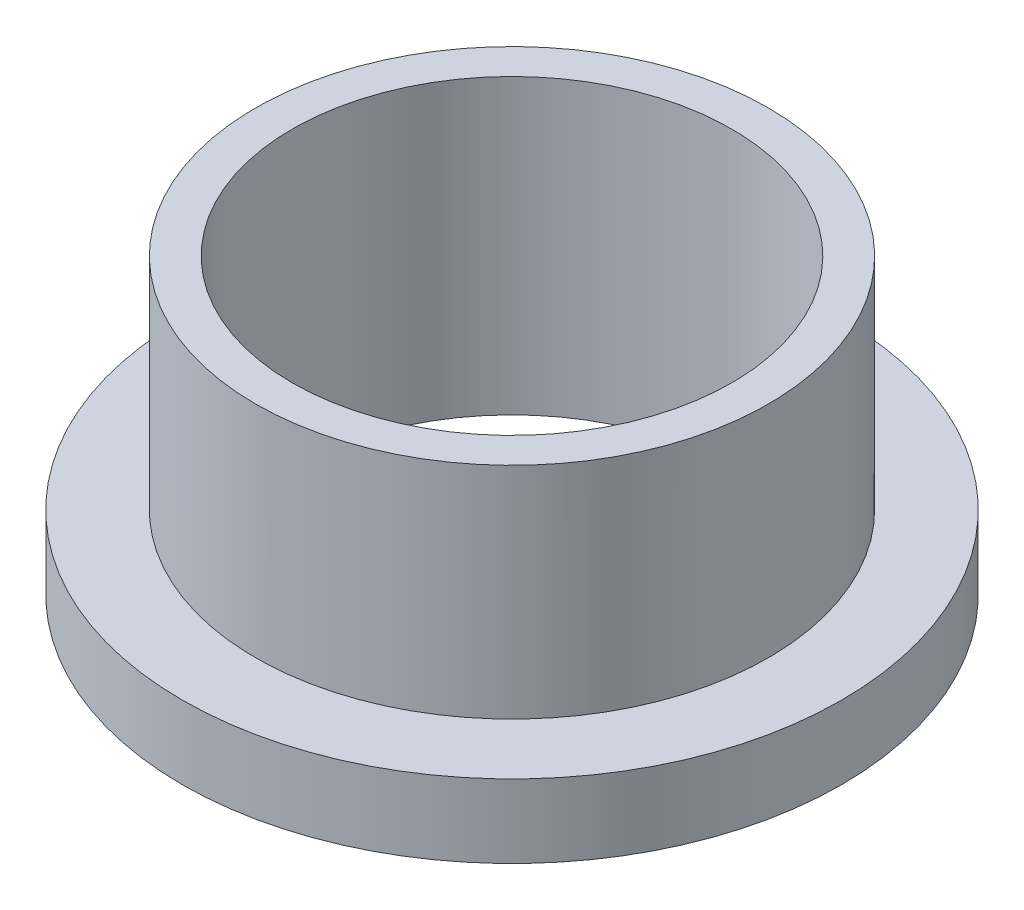
from build123d import *

# Parameters (mm, degrees)
SKETCH1_R           = 11.1125
SKETCH1_R_2         = 9.525
BOSS_EXTRUDE1_DEPTH = 12.7
SKETCH2_R           = 14.2875
SKETCH2_R_2         = 11.1125
BOSS_EXTRUDE2_DEPTH = 3.175


with BuildPart() as part:
    # Sketch1 → Boss-Extrude1 (new body)
    with BuildSketch(Plane(origin=(0, 0, 0), x_dir=(1, 0, 0), z_dir=(0, 1, 0))):
        with Locations(Location((0, 0, 0), (0, 0, 270))):
            Circle(SKETCH1_R)
        with Locations(Location((0, 0, 0), (0, 0, 270))):
            Circle(SKETCH1_R_2, mode=Mode.SUBTRACT)
    extrude(amount=BOSS_EXTRUDE1_DEPTH)

    # Sketch2 → Boss-Extrude2 (add)
    with BuildSketch(Plane.XZ):
        with Locations(Location((0, 0, 0), (0, 0, 270))):
            Circle(SKETCH2_R)
        with Locations(Location((0, 0, 0), (0, 0, 270))):
            Circle(SKETCH2_R_2, mode=Mode.SUBTRACT)
    extrude(amount=-BOSS_EXTRUDE2_DEPTH)


solid = part.part
